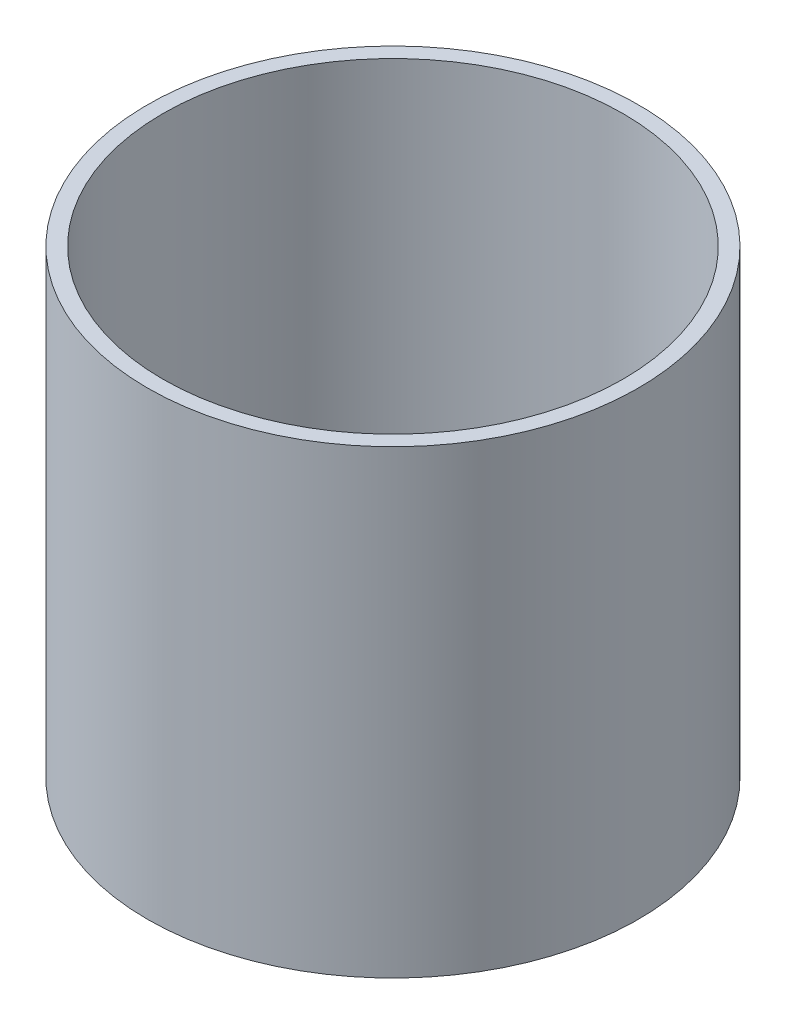
from build123d import *

# Parameters (mm, degrees)
ESQUISSE2_R        = 32
ESQUISSE2_R_2      = 30
BOSS_EXTRU_2_DEPTH = 60
ESQUISSE3_R        = 32
BOSS_EXTRU_3_DEPTH = 1
CONG_1_R           = 10


with BuildPart() as part:
    # Esquisse2 → Boss.-Extru.2 (new body)
    with BuildSketch(Plane(origin=(0, 0, 0), x_dir=(1, 0, 0), z_dir=(0, 1, 0))):
        with Locations(Location((0, 0, 0), (0, 0, 270))):
            Circle(ESQUISSE2_R)
        with Locations(Location((0, 0, 0), (0, 0, 270))):
            Circle(ESQUISSE2_R_2, mode=Mode.SUBTRACT)
    extrude(amount=BOSS_EXTRU_2_DEPTH)

    # Esquisse3 → Boss.-Extru.3 (add)
    with BuildSketch(Plane.XZ):
        with Locations(Location((0, 0, 0), (0, 0, 90))):
            Circle(ESQUISSE3_R)
    extrude(amount=-BOSS_EXTRU_3_DEPTH)

    # Congé1
    cong_1_edges = [part.edges().sort_by_distance(p)[0] for p in [
        (0, 1, -30),
    ]]
    fillet(cong_1_edges, radius=CONG_1_R)


solid = part.part
